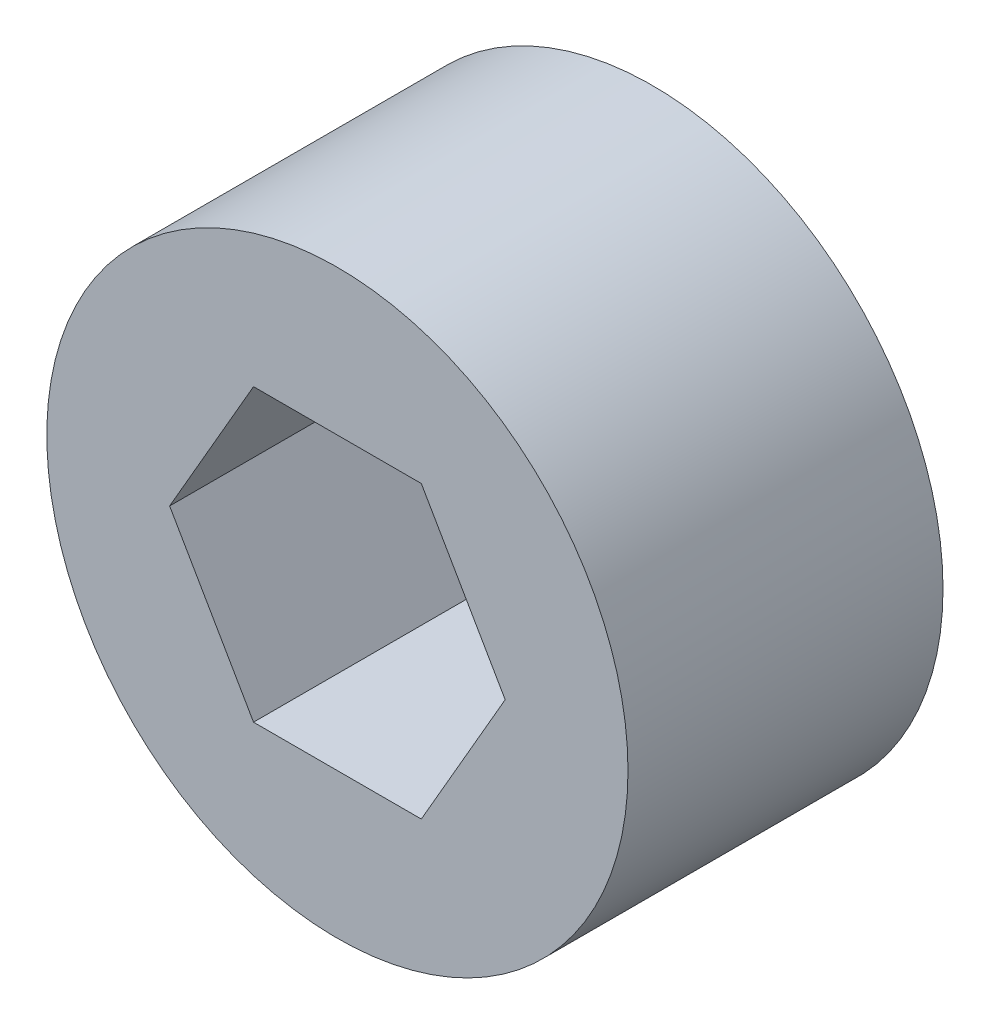
from build123d import *

# Parameters (mm, degrees)
SKETCH1_R           = 12.7
BOSS_EXTRUDE1_DEPTH = 6.8834


with BuildPart() as part:
    # Sketch1 → Boss-Extrude1 (new, symmetric)
    with BuildSketch(Plane.XY):
        Circle(SKETCH1_R)
        Polygon((-7.332348419, 0), (-3.666174209, -6.35), (3.666174209, -6.35), (7.332348419, 0), (3.666174209, 6.35), (-3.666174209, 6.35), align=None, mode=Mode.SUBTRACT)
    extrude(amount=BOSS_EXTRUDE1_DEPTH, both=True)


solid = part.part
